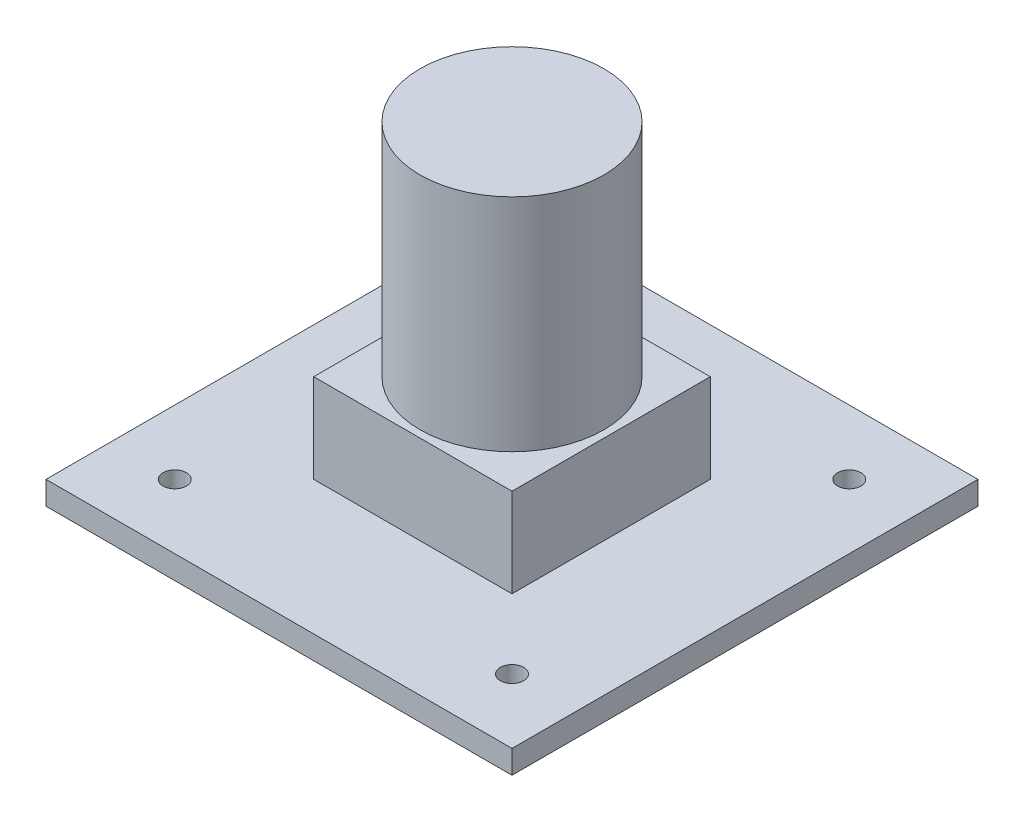
from build123d import *

# Parameters (mm, degrees)
SKETCH1_W           = 38
SKETCH1_H           = 38
BOSS_EXTRUDE1_DEPTH = 1.9
SKETCH2_W           = 16.17
SKETCH2_H           = 16.17
BOSS_EXTRUDE2_DEPTH = 7.25
SKETCH4_R           = 7.5
BOSS_EXTRUDE3_DEPTH = 18
SKETCH5_R           = 0.95
CUT_EXTRUDE1_DEPTH  = 18


with BuildPart() as part:
    # Sketch1 → Boss-Extrude1 (new body)
    with BuildSketch(Plane(origin=(0, 0, 0), x_dir=(1, 0, 0), z_dir=(0, 1, 0))):
        Rectangle(SKETCH1_W, SKETCH1_H)
    extrude(amount=BOSS_EXTRUDE1_DEPTH)

    # Sketch2 → Boss-Extrude2 (add)
    with BuildSketch(Plane(origin=(0, 1.9, 0), x_dir=(1, 0, 0), z_dir=(0, 1, 0))):
        Rectangle(SKETCH2_W, SKETCH2_H)
    extrude(amount=BOSS_EXTRUDE2_DEPTH)

    # Sketch4 → Boss-Extrude3 (add)
    with BuildSketch(Plane(origin=(0, 9.15, 0), x_dir=(1, 0, 0), z_dir=(0, 1, 0))):
        with Locations(Location((0, 0, 0), (0, 0, 270))):
            Circle(SKETCH4_R)
    extrude(amount=BOSS_EXTRUDE3_DEPTH)

    # Sketch5 → Cut-Extrude1 (cut)
    with BuildSketch(Plane(origin=(0, 1.9, 0), x_dir=(1, 0, 0), z_dir=(0, 1, 0))):
        with Locations(Location((-13.75, 13.75, 0), (0, 0, 270))):
            Circle(SKETCH5_R)
        with Locations(Location((13.75, 13.75, 0), (0, 0, 270))):
            Circle(SKETCH5_R)
        with Locations(Location((13.75, -13.75, 0), (0, 0, 270))):
            Circle(SKETCH5_R)
        with Locations(Location((-13.75, -13.75, 0), (0, 0, 270))):
            Circle(SKETCH5_R)
    extrude(amount=-CUT_EXTRUDE1_DEPTH, mode=Mode.SUBTRACT)


solid = part.part
